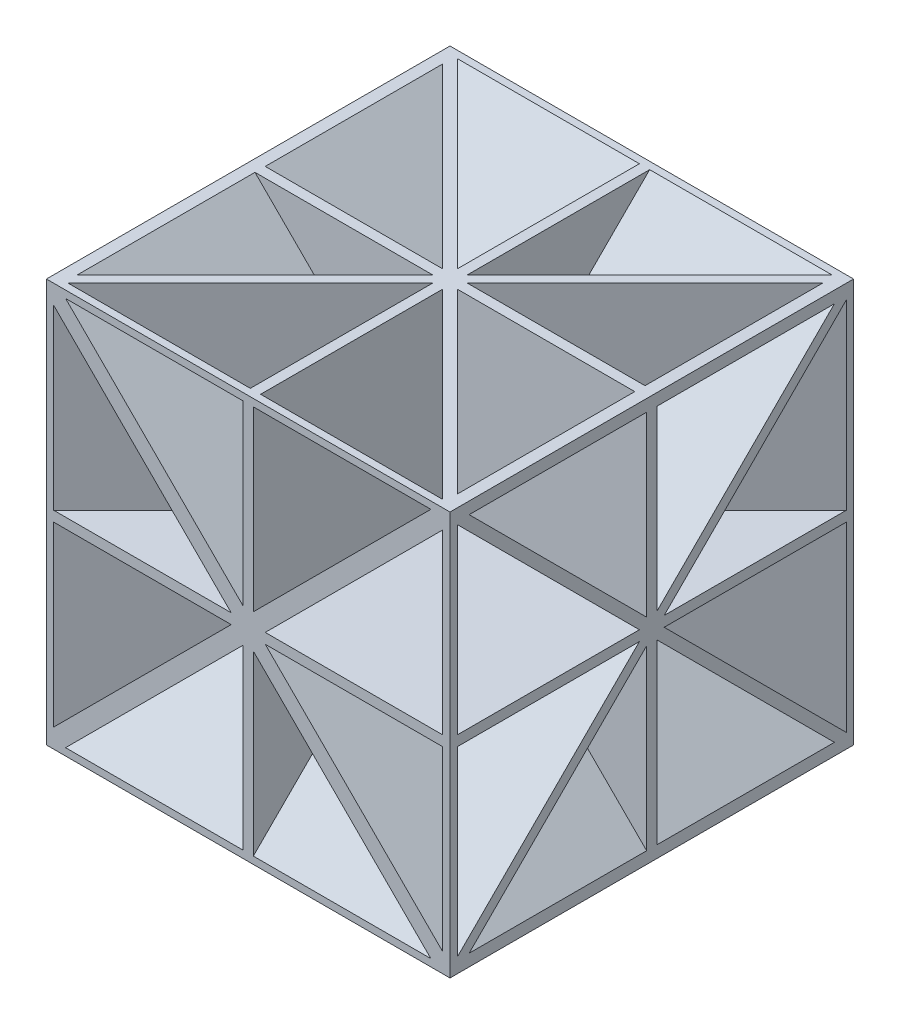
from build123d import *

# Parameters (mm, degrees)
SKETCH2_W               = 25
SKETCH2_H               = 25
BOSS_EXTRUDE1_DEPTH     = 0.305
SKETCH3_W               = 25
SKETCH3_H               = 25
BOSS_EXTRUDE2_DEPTH     = 0.305
SKETCH4_W               = 25
SKETCH4_H               = 25
BOSS_EXTRUDE3_DEPTH     = 0.305
BOSS_EXTRUDE4_DEPTH     = 0.305
CIRPATTERN1_COUNT       = 4
BOSS_EXTRUDE5_DEPTH     = 0.5
CIRPATTERN3_COUNT       = 4
CUT_EXTRUDE1_DEPTH      = 32.084683695
CUT_EXTRUDE1_DEPTH_BACK = 32.084683695
SKETCH10_W              = 32.20248022
SKETCH10_H              = 30.281091186
SKETCH10_W_2            = 24
SKETCH10_H_2            = 24
SKETCH11_W              = 28.880121396
SKETCH11_H              = 26.658573596
SKETCH11_W_2            = 24
SKETCH11_H_2            = 24
CUT_EXTRUDE2_DEPTH      = 37


with BuildPart() as part:
    # Sketch2 → Boss-Extrude1 (new, symmetric)
    with BuildSketch(Plane.XY):
        Rectangle(SKETCH2_W, SKETCH2_H)
    extrude(amount=BOSS_EXTRUDE1_DEPTH, both=True)

    # Sketch3 → Boss-Extrude2 (add, symmetric)
    with BuildSketch(Plane(origin=(0, 0, 0), x_dir=(1, 0, 0), z_dir=(0, 1, 0))):
        Rectangle(SKETCH3_W, SKETCH3_H)
    extrude(amount=BOSS_EXTRUDE2_DEPTH, both=True)

    # Sketch4 → Boss-Extrude3 (add, symmetric)
    with BuildSketch(Plane(origin=(0, 0, 0), x_dir=(0, 0, -1), z_dir=(1, 0, 0))):
        Rectangle(SKETCH4_W, SKETCH4_H)
    extrude(amount=BOSS_EXTRUDE3_DEPTH, both=True)

    # 3DSketch1 → Boss-Extrude4 (add, symmetric)
    with BuildSketch(Plane(origin=(12.5, 12.5, -12.5), x_dir=(-0.5773502691896257, -0.5773502691896257, 0.5773502691896257), z_dir=(0.7071067811865476, 0, 0.7071067811865475))):
        Polygon((0, 0), (14.43375673, 20.412414523), (43.301270189, 0), (28.867513459, -20.412414523), align=None)
    boss_extrude4 = extrude(amount=BOSS_EXTRUDE4_DEPTH, both=True)

    # CirPattern1: Boss-Extrude4 ×4 about axis
    cirpattern1_axis = Axis((0, 0, -14.139022115), (0, 0, 1))
    for i in range(1, CIRPATTERN1_COUNT):
        add(boss_extrude4.rotate(cirpattern1_axis, i * 360 / CIRPATTERN1_COUNT))


with BuildPart() as body_2:
    # 3DSketch2 → Boss-Extrude5 (new, symmetric)
    with BuildSketch(Plane(origin=(12.5, -12.5, -12.5), x_dir=(-0.5773502691896257, 0.5773502691896257, 0.5773502691896257), z_dir=(-0.7071067811865476, -0.7071067811865476, 0))):
        Polygon((0, 0), (28.867513459, 20.412414523), (43.301270189, 0), (14.43375673, -20.412414523), align=None)
    boss_extrude5 = extrude(amount=BOSS_EXTRUDE5_DEPTH, both=True)

    # CirPattern3: Boss-Extrude5 ×4 about axis
    cirpattern3_axis = Axis((0, 0, -14.139022115), (0, 0, 1))
    for i in range(1, CIRPATTERN3_COUNT):
        add(boss_extrude5.rotate(cirpattern3_axis, i * 360 / CIRPATTERN3_COUNT))


with BuildPart() as part_1:
    add(part.part)

    # Combine1: union body 2
    add(body_2.part)

    # Sketch10 → Cut-Extrude1 (cut, two sides: drawn at the far end of the back side and taken through both)
    with BuildSketch(Plane.XY.offset(12.5).offset(-CUT_EXTRUDE1_DEPTH_BACK)):
        Rectangle(SKETCH10_W, SKETCH10_H)
        Rectangle(SKETCH10_W_2, SKETCH10_H_2, mode=Mode.SUBTRACT)
    extrude(amount=CUT_EXTRUDE1_DEPTH + CUT_EXTRUDE1_DEPTH_BACK, mode=Mode.SUBTRACT)

    # Sketch11 → Cut-Extrude2 (cut)
    with BuildSketch(Plane(origin=(12, 0, 0), x_dir=(0, 0, -1), z_dir=(1, 0, 0))):
        Rectangle(SKETCH11_W, SKETCH11_H)
        Rectangle(SKETCH11_W_2, SKETCH11_H_2, mode=Mode.SUBTRACT)
    extrude(amount=-CUT_EXTRUDE2_DEPTH, mode=Mode.SUBTRACT)


solid = part_1.part
